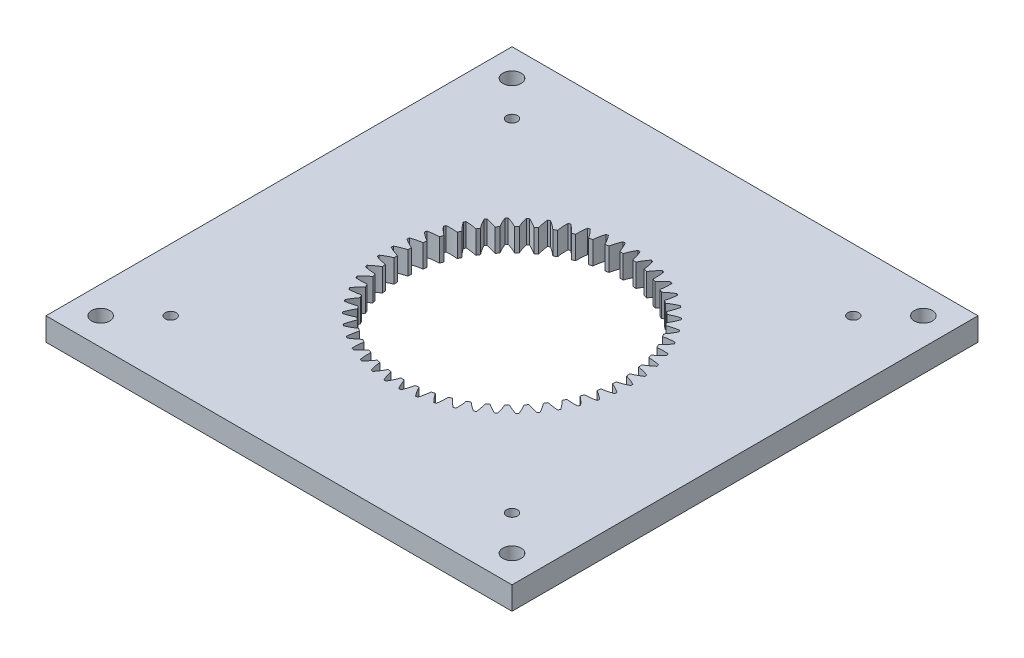
from build123d import *

# Parameters (mm, degrees)
SKETCH1_W           = 101.6
SKETCH1_H           = 101.6
BOSS_EXTRUDE1_DEPTH = 5
CUT_EXTRUDE2_DEPTH  = 157.585803558
SKETCH4_R           = 1.984375
SKETCH4_R_2         = 1.190625
CUT_EXTRUDE3_DEPTH  = 100


with BuildPart() as part:
    # Sketch1 → Boss-Extrude1 (new body)
    with BuildSketch(Plane(origin=(0, 0, 0), x_dir=(1, 0, 0), z_dir=(0, 1, 0))):
        Rectangle(SKETCH1_W, SKETCH1_H)
    extrude(amount=BOSS_EXTRUDE1_DEPTH)

    # Sketch3 → Cut-Extrude2 (cut, through all)
    with BuildSketch(Plane(origin=(-15.120131743, 10, -90.881509403), x_dir=(1, 0, 0), z_dir=(0, 1, 0))):
        with BuildLine():
            ThreePointArc((6.824520842, -66.10962583), (6.693146391, -67.325954488), (6.682533785, -68.549311354))
            ThreePointArc((6.682533785, -68.549311354), (6.331894297, -68.684955355), (5.983434402, -68.826104381))
            ThreePointArc((5.983434402, -68.826104381), (5.138252742, -67.941580434), (4.209850627, -67.144847002))
            ThreePointArc((4.209850627, -67.144847002), (3.99707353, -67.243807484), (3.785193942, -67.344675269))
            ThreePointArc((3.785193942, -67.344675269), (3.807301822, -68.567878397), (3.950100171, -69.782918842))
            ThreePointArc((3.950100171, -69.782918842), (3.619226281, -69.96144003), (3.29120476, -70.145149659))
            ThreePointArc((3.29120476, -70.145149659), (2.341827364, -69.373529798), (1.320888799, -68.699438486))
            ThreePointArc((1.320888799, -68.699438486), (1.122192551, -68.824286677), (0.924625782, -68.950914643))
            ThreePointArc((0.924625782, -68.950914643), (1.099867338, -70.161701597), (1.393824628, -71.349263706))
            ThreePointArc((1.393824628, -71.349263706), (1.087934415, -71.567846696), (0.785524364, -71.791219717))
            ThreePointArc((0.785524364, -71.791219717), (-0.25307652, -71.144672848), (-1.350450724, -70.603854479))
            ThreePointArc((-1.350450724, -70.603854479), (-1.531932565, -70.752621449), (-1.712070769, -70.903012598))
            ThreePointArc((-1.712070769, -70.903012598), (-1.386459201, -72.082288544), (-0.945978853, -73.223643753))
            ThreePointArc((-0.945978853, -73.223643753), (-1.222061317, -73.478841361), (-1.494090712, -73.738355048))
            ThreePointArc((-1.494090712, -73.738355048), (-2.605535727, -73.227077602), (-3.762039322, -72.828061204))
            ThreePointArc((-3.762039322, -72.828061204), (-3.92344468, -72.998400808), (-4.083313431, -73.170183381))
            ThreePointArc((-4.083313431, -73.170183381), (-3.612466939, -74.299350433), (-3.032410172, -75.37649889))
            ThreePointArc((-3.032410172, -75.37649889), (-3.274330902, -75.664286496), (-3.511689574, -75.955848164))
            ThreePointArc((-3.511689574, -75.955848164), (-4.678450569, -75.587903291), (-5.875844803, -75.336981592))
            ThreePointArc((-5.875844803, -75.336981592), (-6.014628218, -75.526207472), (-6.151706291, -75.716672356))
            ThreePointArc((-6.151706291, -75.716672356), (-5.543050407, -76.777922876), (-4.832565061, -77.773877304))
            ThreePointArc((-4.832565061, -77.773877304), (-5.036508822, -78.089716327), (-5.235453484, -78.408727874))
            ThreePointArc((-5.235453484, -78.408727874), (-6.439129941, -78.189918284), (-7.658531192, -78.091048469))
            ThreePointArc((-7.658531192, -78.091048469), (-7.772503966, -78.296176421), (-7.884629558, -78.50231987))
            ThreePointArc((-7.884629558, -78.50231987), (-7.147763148, -79.478917303), (-6.318054003, -80.377970907))
            ThreePointArc((-6.318054003, -80.377970907), (-6.48080448, -80.716880376), (-6.638197655, -81.058310799))
            ThreePointArc((-6.638197655, -81.058310799), (-7.859806877, -80.992087251), (-9.081984458, -81.046828556))
            ThreePointArc((-9.081984458, -81.046828556), (-9.169349174, -81.264623589), (-9.254753997, -81.483194599))
            ThreePointArc((-9.254753997, -81.483194599), (-8.401297885, -82.359737418), (-7.465449948, -83.147711587))
            ThreePointArc((-7.465449948, -83.147711587), (-7.58444047, -83.504346696), (-7.697799974, -83.862811435))
            ThreePointArc((-7.697799974, -83.862811435), (-8.918076454, -83.950218313), (-10.123755895, -84.157707434))
            ThreePointArc((-10.123755895, -84.157707434), (-10.183134758, -84.384734791), (-10.240471927, -84.612286365))
            ThreePointArc((-10.240471927, -84.612286365), (-9.283885625, -85.374950969), (-8.256657779, -86.039418878))
            ThreePointArc((-8.256657779, -86.039418878), (-8.330011794, -86.40815528), (-8.397549878, -86.77800113))
            ThreePointArc((-8.397549878, -86.77800113), (-9.597249127, -87.017659976), (-10.767416144, -87.374624686))
            ThreePointArc((-10.767416144, -87.374624686), (-10.797872714, -87.607304009), (-10.826237987, -87.840247525))
            ThreePointArc((-10.826237987, -87.840247525), (-9.781607433, -88.477006236), (-8.679199674, -89.007488829))
            ThreePointArc((-8.679199674, -89.007488829), (-8.705760345, -89.38251133), (-8.726411895, -89.757905602))
            ThreePointArc((-8.726411895, -89.757905602), (-9.886613939, -90.146036852), (-11.002814298, -90.646847606))
            ThreePointArc((-11.002814298, -90.646847606), (-11.003868257, -90.881509403), (-11.002814298, -91.116171201))
            ThreePointArc((-11.002814298, -91.116171201), (-9.886613939, -91.616981954), (-8.726411895, -92.005113204))
            ThreePointArc((-8.726411895, -92.005113204), (-8.705760345, -92.380507476), (-8.679199674, -92.755529977))
            ThreePointArc((-8.679199674, -92.755529977), (-9.781607433, -93.28601257), (-10.826237987, -93.922771281))
            ThreePointArc((-10.826237987, -93.922771281), (-10.797872714, -94.155714797), (-10.767416144, -94.38839412))
            ThreePointArc((-10.767416144, -94.38839412), (-9.597249127, -94.74535883), (-8.397549878, -94.985017676))
            ThreePointArc((-8.397549878, -94.985017676), (-8.330011794, -95.354863526), (-8.256657779, -95.723599928))
            ThreePointArc((-8.256657779, -95.723599928), (-9.283885625, -96.388067837), (-10.240471927, -97.150732441))
            ThreePointArc((-10.240471927, -97.150732441), (-10.183134758, -97.378284015), (-10.123755895, -97.605311372))
            ThreePointArc((-10.123755895, -97.605311372), (-8.918076454, -97.812800493), (-7.697799974, -97.900207371))
            ThreePointArc((-7.697799974, -97.900207371), (-7.58444047, -98.25867211), (-7.465449948, -98.615307219))
            ThreePointArc((-7.465449948, -98.615307219), (-8.401297885, -99.403281388), (-9.254753997, -100.279824208))
            ThreePointArc((-9.254753997, -100.279824208), (-9.169349174, -100.498395217), (-9.081984458, -100.716190251))
            ThreePointArc((-9.081984458, -100.716190251), (-7.859806877, -100.770931555), (-6.638197655, -100.704708007))
            ThreePointArc((-6.638197655, -100.704708007), (-6.48080448, -101.046138431), (-6.318054003, -101.385047899))
            ThreePointArc((-6.318054003, -101.385047899), (-7.147763148, -102.284101504), (-7.884629558, -103.260698936))
            ThreePointArc((-7.884629558, -103.260698936), (-7.772503966, -103.466842385), (-7.658531192, -103.671970337))
            ThreePointArc((-7.658531192, -103.671970337), (-6.439129941, -103.573100522), (-5.235453484, -103.354290932))
            ThreePointArc((-5.235453484, -103.354290932), (-5.036508822, -103.67330248), (-4.832565061, -103.989141502))
            ThreePointArc((-4.832565061, -103.989141502), (-5.543050407, -104.985095931), (-6.151706291, -106.04634645))
            ThreePointArc((-6.151706291, -106.04634645), (-6.014628218, -106.236811334), (-5.875844803, -106.426037214))
            ThreePointArc((-5.875844803, -106.426037214), (-4.678450569, -106.175115516), (-3.511689574, -105.807170642))
            ThreePointArc((-3.511689574, -105.807170642), (-3.274330902, -106.09873231), (-3.032410172, -106.386519917))
            ThreePointArc((-3.032410172, -106.386519917), (-3.612466939, -107.463668373), (-4.083313431, -108.592835425))
            ThreePointArc((-4.083313431, -108.592835425), (-3.92344468, -108.764617998), (-3.762039322, -108.934957602))
            ThreePointArc((-3.762039322, -108.934957602), (-2.605535727, -108.535941205), (-1.494090712, -108.024663758))
            ThreePointArc((-1.494090712, -108.024663758), (-1.222061317, -108.284177446), (-0.945978853, -108.539375053))
            ThreePointArc((-0.945978853, -108.539375053), (-1.386459201, -109.680730262), (-1.712070769, -110.860006208))
            ThreePointArc((-1.712070769, -110.860006208), (-1.531932565, -111.010397357), (-1.350450724, -111.159164327))
            ThreePointArc((-1.350450724, -111.159164327), (-0.25307652, -110.618345958), (0.785524364, -109.971799089))
            ThreePointArc((0.785524364, -109.971799089), (1.087934415, -110.19517211), (1.393824628, -110.4137551))
            ThreePointArc((1.393824628, -110.4137551), (1.099867338, -111.601317209), (0.924625782, -112.812104163))
            ThreePointArc((0.924625782, -112.812104163), (1.122192551, -112.938732129), (1.320888799, -113.06358032))
            ThreePointArc((1.320888799, -113.06358032), (2.341827364, -112.389489008), (3.29120476, -111.617869147))
            ThreePointArc((3.29120476, -111.617869147), (3.619226281, -111.801578776), (3.950100171, -111.980099964))
            ThreePointArc((3.950100171, -111.980099964), (3.807301822, -113.195140409), (3.785193942, -114.418343537))
            ThreePointArc((3.785193942, -114.418343537), (3.99707353, -114.519211322), (4.209850627, -114.618171805))
            ThreePointArc((4.209850627, -114.618171805), (5.138252742, -113.821438372), (5.983434402, -112.936914425))
            ThreePointArc((5.983434402, -112.936914425), (6.331894297, -113.078063451), (6.682533785, -113.213707452))
            ThreePointArc((6.682533785, -113.213707452), (6.693146391, -114.437064319), (6.824520842, -115.653392976))
            ThreePointArc((6.824520842, -115.653392976), (7.047371782, -115.726909835), (7.270874105, -115.798421943))
            ThreePointArc((7.270874105, -115.798421943), (8.092098315, -114.891611353), (8.819755218, -113.908132791))
            ThreePointArc((8.819755218, -113.908132791), (9.183158067, -114.004495209), (9.548033359, -114.095122836))
            ThreePointArc((9.548033359, -114.095122836), (9.711889554, -115.307503056), (9.994674481, -116.497775014))
            ThreePointArc((9.994674481, -116.497775014), (10.224982281, -116.542781541), (10.455685065, -116.585717486))
            ThreePointArc((10.455685065, -116.585717486), (11.156780174, -115.583130683), (11.755436736, -114.51620755))
            ThreePointArc((11.755436736, -114.51620755), (12.128051458, -114.566263668), (12.501408253, -114.610445668))
            ThreePointArc((12.501408253, -114.610445668), (12.815923926, -115.792729282), (13.245659643, -116.938173241))
            ThreePointArc((13.245659643, -116.938173241), (13.479792211, -116.953959657), (13.714057136, -116.967642313))
            ThreePointArc((13.714057136, -116.967642313), (14.283966454, -115.885090689), (14.744181505, -114.751549001))
            ThreePointArc((14.744181505, -114.751549001), (15.120131743, -114.754509403), (15.496081981, -114.751549001))
            ThreePointArc((15.496081981, -114.751549001), (15.956297032, -115.885090689), (16.526206351, -116.967642313))
            ThreePointArc((16.526206351, -116.967642313), (16.760471275, -116.953959657), (16.994603843, -116.938173241))
            ThreePointArc((16.994603843, -116.938173241), (17.42433956, -115.792729282), (17.738855233, -114.610445668))
            ThreePointArc((17.738855233, -114.610445668), (18.112212028, -114.566263668), (18.48482675, -114.51620755))
            ThreePointArc((18.48482675, -114.51620755), (19.083483313, -115.583130683), (19.784578421, -116.585717486))
            ThreePointArc((19.784578421, -116.585717486), (20.015281205, -116.542781541), (20.245589005, -116.497775014))
            ThreePointArc((20.245589005, -116.497775014), (20.528373933, -115.307503056), (20.692230127, -114.095122836))
            ThreePointArc((20.692230127, -114.095122836), (21.057105419, -114.004495209), (21.420508268, -113.908132791))
            ThreePointArc((21.420508268, -113.908132791), (22.148165171, -114.891611353), (22.969389381, -115.798421943))
            ThreePointArc((22.969389381, -115.798421943), (23.192891704, -115.726909835), (23.415742644, -115.653392976))
            ThreePointArc((23.415742644, -115.653392976), (23.547117095, -114.437064319), (23.557729701, -113.213707452))
            ThreePointArc((23.557729701, -113.213707452), (23.908369189, -113.078063451), (24.256829084, -112.936914425))
            ThreePointArc((24.256829084, -112.936914425), (25.102010744, -113.821438372), (26.030412859, -114.618171805))
            ThreePointArc((26.030412859, -114.618171805), (26.243189956, -114.519211322), (26.455069544, -114.418343537))
            ThreePointArc((26.455069544, -114.418343537), (26.432961664, -113.195140409), (26.290163315, -111.980099964))
            ThreePointArc((26.290163315, -111.980099964), (26.621037205, -111.801578776), (26.949058726, -111.617869147))
            ThreePointArc((26.949058726, -111.617869147), (27.898436122, -112.389489008), (28.919374687, -113.06358032))
            ThreePointArc((28.919374687, -113.06358032), (29.118070935, -112.938732129), (29.315637704, -112.812104163))
            ThreePointArc((29.315637704, -112.812104163), (29.140396148, -111.601317209), (28.846438859, -110.4137551))
            ThreePointArc((28.846438859, -110.4137551), (29.152329071, -110.19517211), (29.454739122, -109.971799089))
            ThreePointArc((29.454739122, -109.971799089), (30.493340006, -110.618345958), (31.59071421, -111.159164327))
            ThreePointArc((31.59071421, -111.159164327), (31.772196051, -111.010397357), (31.952334255, -110.860006208))
            ThreePointArc((31.952334255, -110.860006208), (31.626722687, -109.680730262), (31.186242339, -108.539375053))
            ThreePointArc((31.186242339, -108.539375053), (31.462324803, -108.284177446), (31.734354198, -108.024663758))
            ThreePointArc((31.734354198, -108.024663758), (32.845799213, -108.535941205), (34.002302808, -108.934957602))
            ThreePointArc((34.002302808, -108.934957602), (34.163708166, -108.764617998), (34.323576917, -108.592835425))
            ThreePointArc((34.323576917, -108.592835425), (33.852730426, -107.463668373), (33.272673658, -106.386519917))
            ThreePointArc((33.272673658, -106.386519917), (33.514594388, -106.09873231), (33.75195306, -105.807170642))
            ThreePointArc((33.75195306, -105.807170642), (34.918714055, -106.175115516), (36.116108289, -106.426037214))
            ThreePointArc((36.116108289, -106.426037214), (36.254891704, -106.236811334), (36.391969777, -106.04634645))
            ThreePointArc((36.391969777, -106.04634645), (35.783313893, -104.985095931), (35.072828547, -103.989141502))
            ThreePointArc((35.072828547, -103.989141502), (35.276772309, -103.67330248), (35.47571697, -103.354290932))
            ThreePointArc((35.47571697, -103.354290932), (36.679393427, -103.573100522), (37.898794678, -103.671970337))
            ThreePointArc((37.898794678, -103.671970337), (38.012767453, -103.466842385), (38.124893044, -103.260698936))
            ThreePointArc((38.124893044, -103.260698936), (37.388026634, -102.284101504), (36.558317489, -101.385047899))
            ThreePointArc((36.558317489, -101.385047899), (36.721067967, -101.046138431), (36.878461141, -100.704708007))
            ThreePointArc((36.878461141, -100.704708007), (38.100070363, -100.770931555), (39.322247945, -100.716190251))
            ThreePointArc((39.322247945, -100.716190251), (39.40961266, -100.498395217), (39.495017483, -100.279824208))
            ThreePointArc((39.495017483, -100.279824208), (38.641561371, -99.403281388), (37.705713434, -98.615307219))
            ThreePointArc((37.705713434, -98.615307219), (37.824703957, -98.25867211), (37.93806346, -97.900207371))
            ThreePointArc((37.93806346, -97.900207371), (39.15833994, -97.812800493), (40.364019381, -97.605311372))
            ThreePointArc((40.364019381, -97.605311372), (40.423398244, -97.378284015), (40.480735413, -97.150732441))
            ThreePointArc((40.480735413, -97.150732441), (39.524149111, -96.388067837), (38.496921265, -95.723599928))
            ThreePointArc((38.496921265, -95.723599928), (38.57027528, -95.354863526), (38.637813365, -94.985017676))
            ThreePointArc((38.637813365, -94.985017676), (39.837512614, -94.74535883), (41.00767963, -94.38839412))
            ThreePointArc((41.00767963, -94.38839412), (41.0381362, -94.155714797), (41.066501473, -93.922771281))
            ThreePointArc((41.066501473, -93.922771281), (40.02187092, -93.28601257), (38.91946316, -92.755529977))
            ThreePointArc((38.91946316, -92.755529977), (38.946023831, -92.380507476), (38.966675381, -92.005113204))
            ThreePointArc((38.966675381, -92.005113204), (40.126877425, -91.616981954), (41.243077784, -91.116171201))
            ThreePointArc((41.243077784, -91.116171201), (41.244131743, -90.881509403), (41.243077784, -90.646847606))
            ThreePointArc((41.243077784, -90.646847606), (40.126877425, -90.146036852), (38.966675381, -89.757905602))
            ThreePointArc((38.966675381, -89.757905602), (38.946023831, -89.38251133), (38.91946316, -89.007488829))
            ThreePointArc((38.91946316, -89.007488829), (40.02187092, -88.477006236), (41.066501473, -87.840247525))
            ThreePointArc((41.066501473, -87.840247525), (41.0381362, -87.607304009), (41.00767963, -87.374624686))
            ThreePointArc((41.00767963, -87.374624686), (39.837512614, -87.017659976), (38.637813365, -86.77800113))
            ThreePointArc((38.637813365, -86.77800113), (38.57027528, -86.40815528), (38.496921265, -86.039418878))
            ThreePointArc((38.496921265, -86.039418878), (39.524149111, -85.374950969), (40.480735413, -84.612286365))
            ThreePointArc((40.480735413, -84.612286365), (40.423398244, -84.384734791), (40.364019381, -84.157707434))
            ThreePointArc((40.364019381, -84.157707434), (39.15833994, -83.950218313), (37.93806346, -83.862811435))
            ThreePointArc((37.93806346, -83.862811435), (37.824703957, -83.504346696), (37.705713434, -83.147711587))
            ThreePointArc((37.705713434, -83.147711587), (38.641561371, -82.359737418), (39.495017483, -81.483194599))
            ThreePointArc((39.495017483, -81.483194599), (39.40961266, -81.264623589), (39.322247945, -81.046828556))
            ThreePointArc((39.322247945, -81.046828556), (38.100070363, -80.992087251), (36.878461141, -81.058310799))
            ThreePointArc((36.878461141, -81.058310799), (36.721067967, -80.716880376), (36.558317489, -80.377970907))
            ThreePointArc((36.558317489, -80.377970907), (37.388026634, -79.478917303), (38.124893044, -78.50231987))
            ThreePointArc((38.124893044, -78.50231987), (38.012767453, -78.296176421), (37.898794678, -78.091048469))
            ThreePointArc((37.898794678, -78.091048469), (36.679393427, -78.189918284), (35.47571697, -78.408727874))
            ThreePointArc((35.47571697, -78.408727874), (35.276772309, -78.089716327), (35.072828547, -77.773877304))
            ThreePointArc((35.072828547, -77.773877304), (35.783313893, -76.777922876), (36.391969777, -75.716672356))
            ThreePointArc((36.391969777, -75.716672356), (36.254891704, -75.526207472), (36.116108289, -75.336981592))
            ThreePointArc((36.116108289, -75.336981592), (34.918714055, -75.587903291), (33.75195306, -75.955848164))
            ThreePointArc((33.75195306, -75.955848164), (33.514594388, -75.664286496), (33.272673658, -75.37649889))
            ThreePointArc((33.272673658, -75.37649889), (33.852730426, -74.299350433), (34.323576917, -73.170183381))
            ThreePointArc((34.323576917, -73.170183381), (34.163708166, -72.998400808), (34.002302808, -72.828061204))
            ThreePointArc((34.002302808, -72.828061204), (32.845799213, -73.227077602), (31.734354198, -73.738355048))
            ThreePointArc((31.734354198, -73.738355048), (31.462324803, -73.478841361), (31.186242339, -73.223643753))
            ThreePointArc((31.186242339, -73.223643753), (31.626722687, -72.082288544), (31.952334255, -70.903012598))
            ThreePointArc((31.952334255, -70.903012598), (31.772196051, -70.752621449), (31.59071421, -70.603854479))
            ThreePointArc((31.59071421, -70.603854479), (30.493340006, -71.144672848), (29.454739122, -71.791219717))
            ThreePointArc((29.454739122, -71.791219717), (29.152329071, -71.567846696), (28.846438859, -71.349263706))
            ThreePointArc((28.846438859, -71.349263706), (29.140396148, -70.161701597), (29.315637704, -68.950914643))
            ThreePointArc((29.315637704, -68.950914643), (29.118070935, -68.824286677), (28.919374687, -68.699438486))
            ThreePointArc((28.919374687, -68.699438486), (27.898436122, -69.373529798), (26.949058726, -70.145149659))
            ThreePointArc((26.949058726, -70.145149659), (26.621037205, -69.96144003), (26.290163315, -69.782918842))
            ThreePointArc((26.290163315, -69.782918842), (26.432961664, -68.567878397), (26.455069544, -67.344675269))
            ThreePointArc((26.455069544, -67.344675269), (26.243189956, -67.243807484), (26.030412859, -67.144847002))
            ThreePointArc((26.030412859, -67.144847002), (25.102010744, -67.941580434), (24.256829084, -68.826104381))
            ThreePointArc((24.256829084, -68.826104381), (23.908369189, -68.684955355), (23.557729701, -68.549311354))
            ThreePointArc((23.557729701, -68.549311354), (23.547117095, -67.325954488), (23.415742644, -66.10962583))
            ThreePointArc((23.415742644, -66.10962583), (23.192891704, -66.036108971), (22.969389381, -65.964596863))
            ThreePointArc((22.969389381, -65.964596863), (22.148165171, -66.871407453), (21.420508268, -67.854886015))
            ThreePointArc((21.420508268, -67.854886015), (21.057105419, -67.758523597), (20.692230127, -67.66789597))
            ThreePointArc((20.692230127, -67.66789597), (20.528373933, -66.45551575), (20.245589005, -65.265243792))
            ThreePointArc((20.245589005, -65.265243792), (20.015281205, -65.220237265), (19.784578421, -65.17730132))
            ThreePointArc((19.784578421, -65.17730132), (19.083483313, -66.179888124), (18.48482675, -67.246811256))
            ThreePointArc((18.48482675, -67.246811256), (18.112212028, -67.196755139), (17.738855233, -67.152573138))
            ThreePointArc((17.738855233, -67.152573138), (17.42433956, -65.970289525), (16.994603843, -64.824845565))
            ThreePointArc((16.994603843, -64.824845565), (16.760471275, -64.80905915), (16.526206351, -64.795376493))
            ThreePointArc((16.526206351, -64.795376493), (15.956297032, -65.877928117), (15.496081981, -67.011469805))
            ThreePointArc((15.496081981, -67.011469805), (15.120131743, -67.008509403), (14.744181505, -67.011469805))
            ThreePointArc((14.744181505, -67.011469805), (14.283966454, -65.877928117), (13.714057136, -64.795376493))
            ThreePointArc((13.714057136, -64.795376493), (13.479792211, -64.80905915), (13.245659643, -64.824845565))
            ThreePointArc((13.245659643, -64.824845565), (12.815923926, -65.970289525), (12.501408253, -67.152573138))
            ThreePointArc((12.501408253, -67.152573138), (12.128051458, -67.196755139), (11.755436736, -67.246811256))
            ThreePointArc((11.755436736, -67.246811256), (11.156780174, -66.179888124), (10.455685065, -65.17730132))
            ThreePointArc((10.455685065, -65.17730132), (10.224982281, -65.220237265), (9.994674481, -65.265243792))
            ThreePointArc((9.994674481, -65.265243792), (9.711889554, -66.45551575), (9.548033359, -67.66789597))
            ThreePointArc((9.548033359, -67.66789597), (9.183158067, -67.758523597), (8.819755218, -67.854886015))
            ThreePointArc((8.819755218, -67.854886015), (8.092098315, -66.871407453), (7.270874105, -65.964596863))
            ThreePointArc((7.270874105, -65.964596863), (7.047371782, -66.036108971), (6.824520842, -66.10962583))
        make_face()
    extrude(amount=-CUT_EXTRUDE2_DEPTH, mode=Mode.SUBTRACT)

    # Sketch4 → Cut-Extrude3 (cut)
    with BuildSketch(Plane(origin=(-15.120131743, -5, -90.881509403), x_dir=(1, 0, 0), z_dir=(0, -1, 0))):
        with Locations(Location((-29.723568257, 135.725209403, 0), (0, 0, 270))):
            Circle(SKETCH4_R)
        with Locations(Location((52.331131743, 128.092509403, 0), (0, 0, 270))):
            Circle(SKETCH4_R_2)
        with Locations(Location((-22.090868257, 128.092509403, 0), (0, 0, 270))):
            Circle(SKETCH4_R_2)
        with Locations(Location((59.963831743, 135.725209403, 0), (0, 0, 270))):
            Circle(SKETCH4_R)
        with Locations(Location((52.331131743, 53.670509403, 0), (0, 0, 270))):
            Circle(SKETCH4_R_2)
        with Locations(Location((59.963831743, 46.037809403, 0), (0, 0, 270))):
            Circle(SKETCH4_R)
        with Locations(Location((-22.090868257, 53.670509403, 0), (0, 0, 270))):
            Circle(SKETCH4_R_2)
        with Locations(Location((-29.723568257, 46.037809403, 0), (0, 0, 270))):
            Circle(SKETCH4_R)
    extrude(amount=-CUT_EXTRUDE3_DEPTH, mode=Mode.SUBTRACT)


solid = part.part
